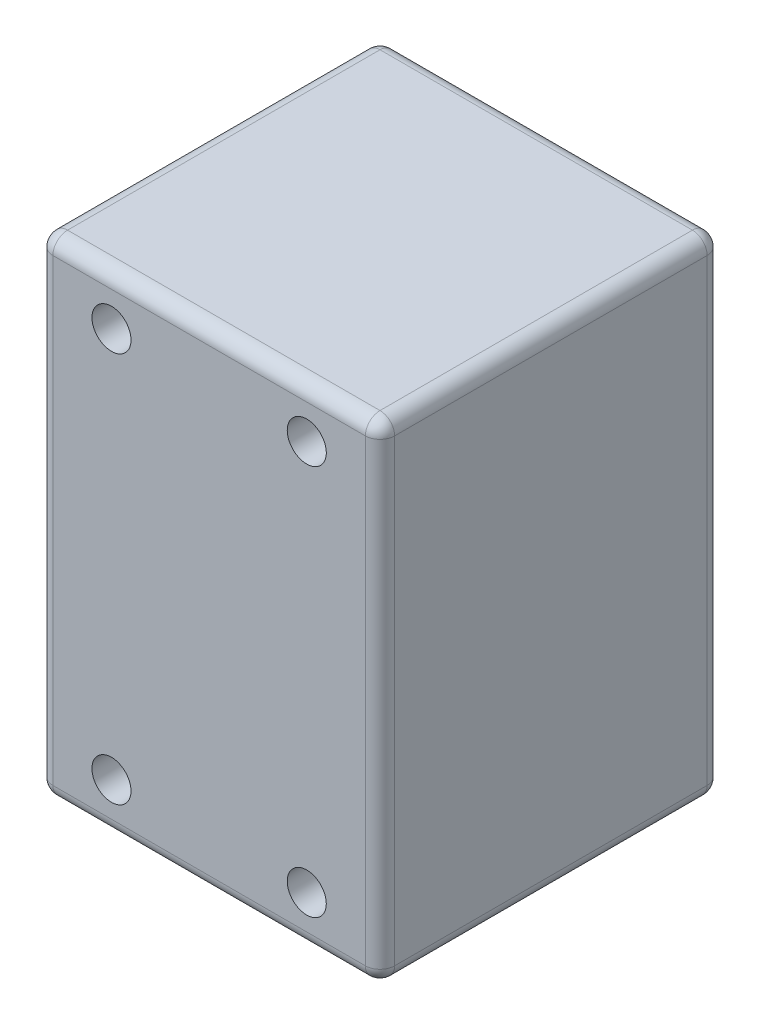
from build123d import *

# Parameters (mm, degrees)
SKETCH1_W           = 70
SKETCH1_H           = 100
BOSS_EXTRUDE1_DEPTH = 70
SKETCH2_R           = 4
CUT_EXTRUDE1_DEPTH  = 93.870878105
FILLET1_R           = 3


with BuildPart() as part:
    # Sketch1 → Boss-Extrude1 (new body)
    with BuildSketch(Plane.XY):
        Rectangle(SKETCH1_W, SKETCH1_H)
    extrude(amount=BOSS_EXTRUDE1_DEPTH)

    # Sketch2 → Cut-Extrude1 (cut, through all)
    with BuildSketch(Plane.XY.offset(70)):
        with Locations((-20, 40)):
            Circle(SKETCH2_R)
        with Locations(Location((-20, -40, 0), (0, 0, 180))):
            Circle(SKETCH2_R)
        with Locations((20, -40)):
            Circle(SKETCH2_R)
        with Locations(Location((20, 40, 0), (0, 0, 180))):
            Circle(SKETCH2_R)
    extrude(amount=-CUT_EXTRUDE1_DEPTH, mode=Mode.SUBTRACT)

    # Fillet1
    fillet1_edges = [part.edges().sort_by_distance(p)[0] for p in [
        (-35, 0, 70),
        (0, -50, 70),
        (35, 0, 70),
        (0, -50, 0),
        (-35, 0, 0),
        (0, 50, 0),
        (35, 0, 0),
        (0, 50, 70),
        (35, -50, 35),
        (-35, -50, 35),
        (-35, 50, 35),
        (35, 50, 35),
    ]]
    fillet(fillet1_edges, radius=FILLET1_R)


solid = part.part
